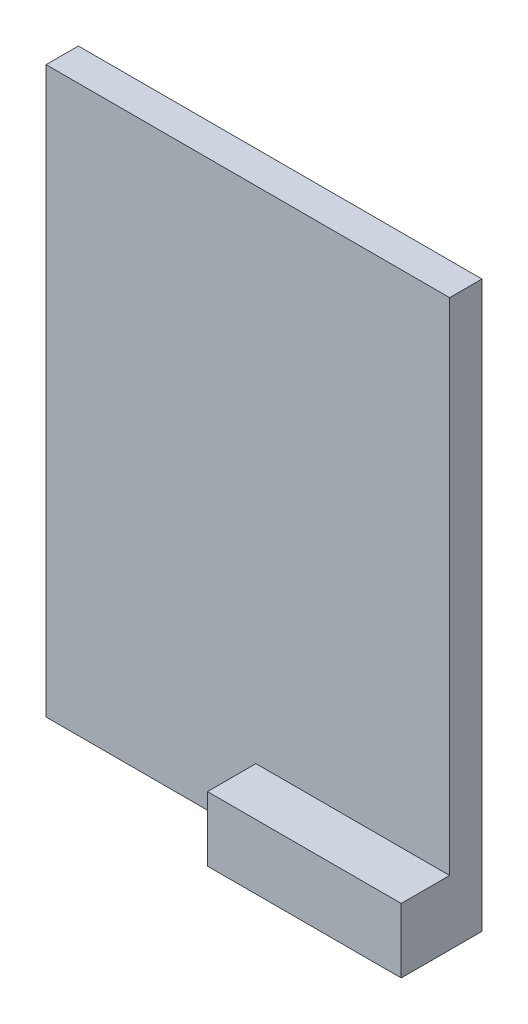
from build123d import *

# Parameters (mm, degrees)
CROQUIS1_W              = 25
CROQUIS1_H              = 35
SALIENTE_EXTRUIR1_DEPTH = 2
CROQUIS2_W              = 12
CROQUIS2_H              = 4
SALIENTE_EXTRUIR2_DEPTH = 3


with BuildPart() as part:
    # Croquis1 → Saliente-Extruir1 (new body)
    with BuildSketch(Plane.XY):
        with Locations((-28.152566884, -5.555555556)):
            Rectangle(CROQUIS1_W, CROQUIS1_H)
    extrude(amount=SALIENTE_EXTRUIR1_DEPTH)

    # Croquis2 → Saliente-Extruir2 (add)
    with BuildSketch(Plane.XY.offset(2)):
        with Locations((-21.652566884, -21.055555556)):
            Rectangle(CROQUIS2_W, CROQUIS2_H)
    extrude(amount=SALIENTE_EXTRUIR2_DEPTH)


solid = part.part
